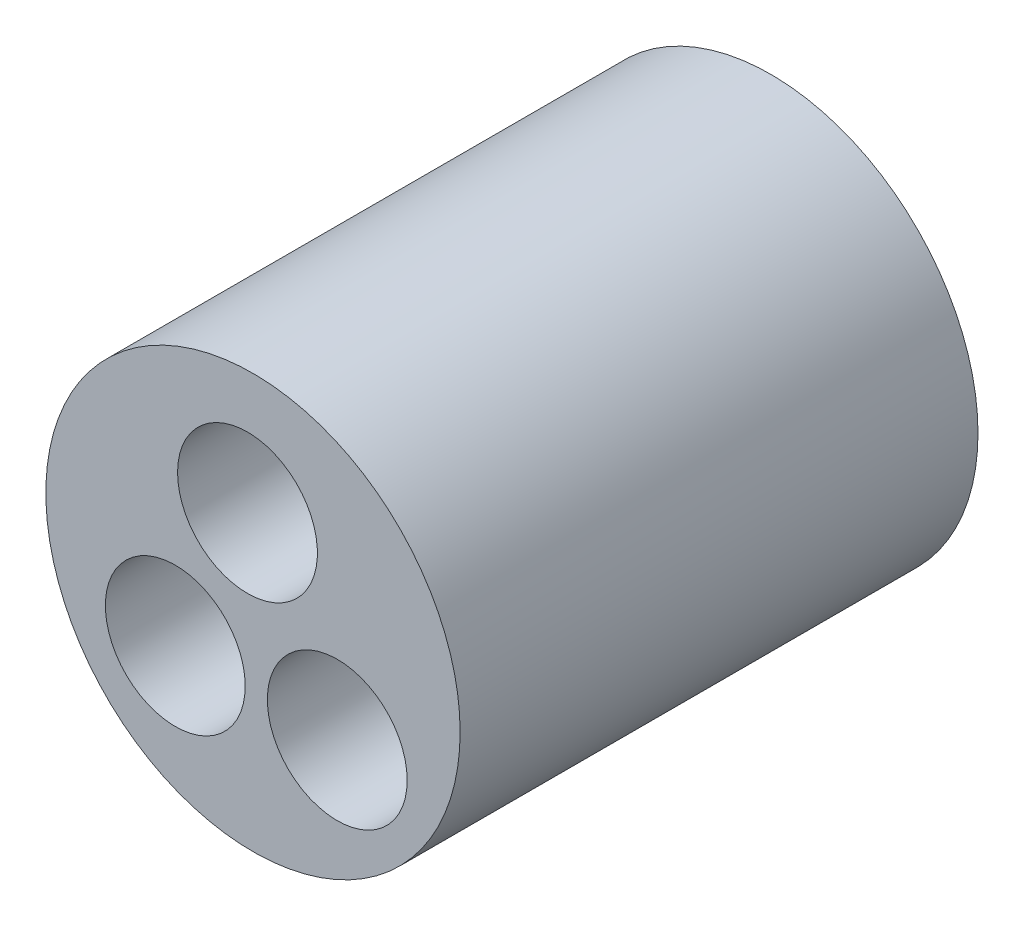
from build123d import *

# Parameters (mm, degrees)
SKETCH5_R           = 4
BOSS_EXTRUDE2_DEPTH = 10
SKETCH6_R           = 2.75
CUT_EXTRUDE4_DEPTH  = 5.2
SKETCH7_R           = 2.2
CUT_EXTRUDE5_DEPTH  = 1
SKETCH9_R           = 1.35
CUT_EXTRUDE6_DEPTH  = 15.623631801
SKETCH10_R          = 1.35
CUT_EXTRUDE7_DEPTH  = 16.81440762
SKETCH11_R          = 1.35
CUT_EXTRUDE8_DEPTH  = 17.02035176


with BuildPart() as part:
    # Sketch5 → Boss-Extrude2 (new body)
    with BuildSketch(Plane.XY):
        with Locations((7.579960637, 0)):
            Circle(SKETCH5_R)
    extrude(amount=BOSS_EXTRUDE2_DEPTH)

    # Sketch6 → Cut-Extrude4 (cut)
    with BuildSketch(Plane(origin=(0, 0, 0), x_dir=(-1, 0, 0), z_dir=(0, 0, -1))):
        with Locations((-7.579960637, 0)):
            Circle(SKETCH6_R)
    extrude(amount=-CUT_EXTRUDE4_DEPTH, mode=Mode.SUBTRACT)

    # Sketch7 → Cut-Extrude5 (cut)
    with BuildSketch(Plane(origin=(0, 0, 5.2), x_dir=(-1, 0, 0), z_dir=(0, 0, -1))):
        with Locations((-7.579960637, 0)):
            Circle(SKETCH7_R)
    extrude(amount=-CUT_EXTRUDE5_DEPTH, mode=Mode.SUBTRACT)

    # Sketch9 → Cut-Extrude6 (cut, through all)
    with BuildSketch(Plane(origin=(-0.808601663, 0.683388857, 6.2), x_dir=(-1, 0, 0), z_dir=(0, 0, -1))):
        with Locations((-8.28220496, 0.932237564)):
            Circle(SKETCH9_R)
    extrude(amount=-CUT_EXTRUDE6_DEPTH, mode=Mode.SUBTRACT)

    # Sketch10 → Cut-Extrude7 (cut, through all)
    with BuildSketch(Plane.XY.offset(10)):
        with Locations((6.079595945, -1.307435574)):
            Circle(SKETCH10_R)
    extrude(amount=-CUT_EXTRUDE7_DEPTH, mode=Mode.SUBTRACT)

    # Sketch11 → Cut-Extrude8 (cut, through all)
    with BuildSketch(Plane(origin=(0, 0.749334917, 10), x_dir=(1, 0, 0), z_dir=(0, 0, 1))):
        with Locations((9.207532027, -2.067387295)):
            Circle(SKETCH11_R)
    extrude(amount=-CUT_EXTRUDE8_DEPTH, mode=Mode.SUBTRACT)


solid = part.part
